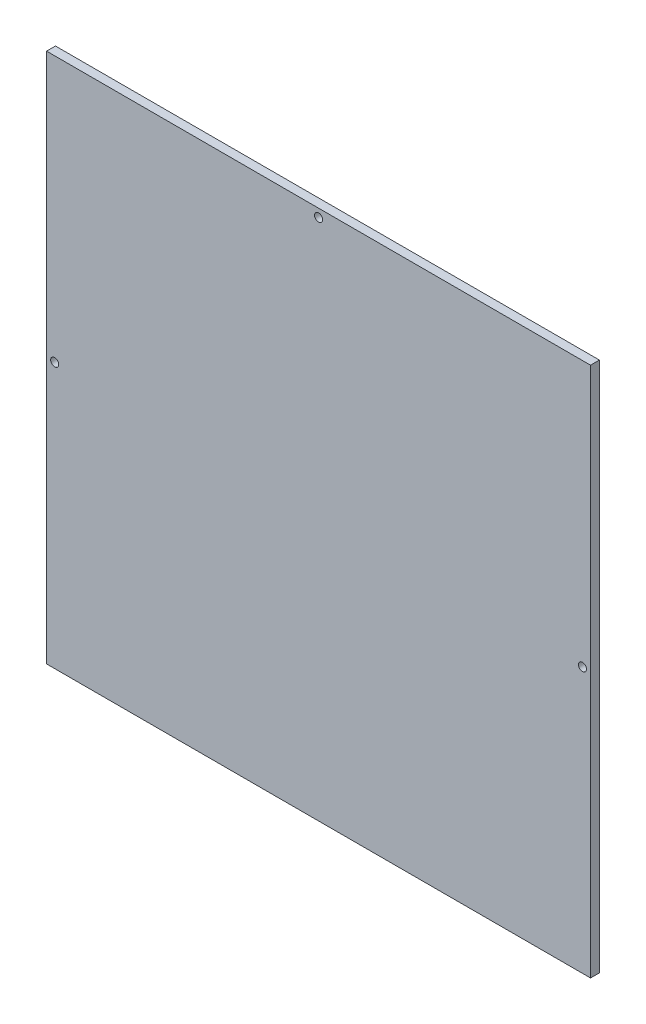
from build123d import *

# Parameters (mm, degrees)
SKETCH1_W           = 202.2
SKETCH1_H           = 197.28
SKETCH1_R           = 1.5
BOSS_EXTRUDE1_DEPTH = 3.3


with BuildPart() as part:
    # Sketch1 → Boss-Extrude1 (new body)
    with BuildSketch(Plane.XY):
        Rectangle(SKETCH1_W, SKETCH1_H)
        with Locations((0, 95.64)):
            Circle(SKETCH1_R, mode=Mode.SUBTRACT)
        with Locations((-98.1, 0)):
            Circle(SKETCH1_R, mode=Mode.SUBTRACT)
        with Locations(Location((98.1, 0, 0), (0, 0, 180))):
            Circle(SKETCH1_R, mode=Mode.SUBTRACT)
    extrude(amount=BOSS_EXTRUDE1_DEPTH)


solid = part.part
